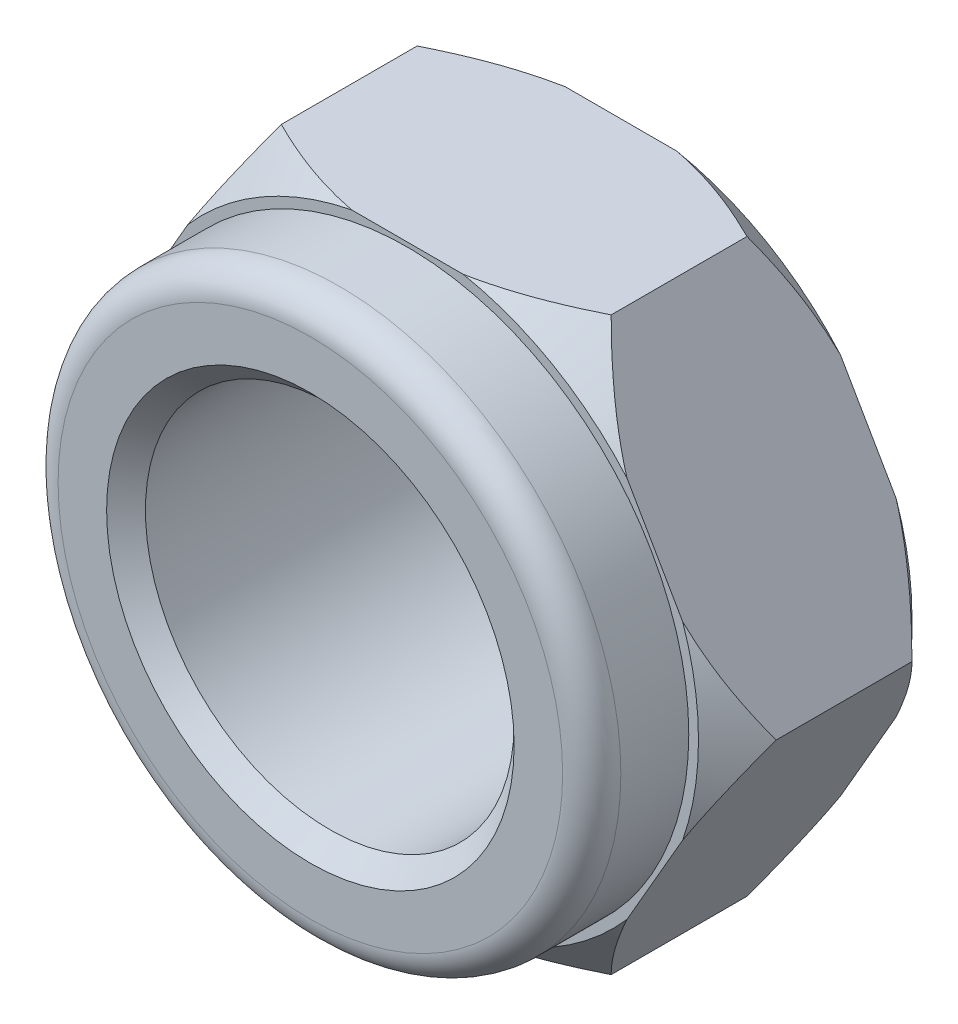
from build123d import *

# Parameters (mm, degrees)
ESQUISSE1_R                  = 17
CORPS_DE_MANOEUVRE_DEPTH     = 11
ESQUISSE2_R                  = 14.5
ORGANE_DE_FREIN_DEPTH        = 5
ESQUISSE3_R                  = 9.5
PER_AGE_DEPTH                = 29.879058156
CHANFREIN_DE_MANOEUVRE_SIZE  = 2
HEXAGON_INSCRIBED1_OUTSIDE_W = 46.136
HEXAGON_INSCRIBED1_OUTSIDE_H = 46.136
MANOEUVRE_DEPTH              = 39.920108467
CONG_1_R                     = 1.5
CHANFREIN2_SIZE              = 1


with BuildPart() as part:
    # Esquisse1 → corps de manoeuvre (new body)
    with BuildSketch(Plane.XY):
        Circle(ESQUISSE1_R)
    extrude(amount=CORPS_DE_MANOEUVRE_DEPTH)

    # Esquisse2 → organe de frein (add)
    with BuildSketch(Plane.XY.offset(11)):
        Circle(ESQUISSE2_R)
    extrude(amount=ORGANE_DE_FREIN_DEPTH)

    # Esquisse3 → perçage (cut, through all)
    with BuildSketch(Plane.XY.offset(16)):
        Circle(ESQUISSE3_R)
    extrude(amount=-PER_AGE_DEPTH, mode=Mode.SUBTRACT)

    # Chanfrein de manoeuvre
    chanfrein_de_manoeuvre_edges = [part.edges().sort_by_distance(p)[0] for p in [
        (-17, 0, 0),
        (-17, 0, 11),
    ]]
    chamfer(chanfrein_de_manoeuvre_edges, length=CHANFREIN_DE_MANOEUVRE_SIZE)

    # Hexagon - inscribed1 outside → manoeuvre (cut, through all)
    with BuildSketch(Plane(origin=(1.77823943, 13.102368129, 0), x_dir=(-1, 0, 0), z_dir=(0, 0, -1))):
        with Locations((1.778, -13.102)):
            Rectangle(HEXAGON_INSCRIBED1_OUTSIDE_W, HEXAGON_INSCRIBED1_OUTSIDE_H)
        Polygon((18.77823943, -13.102368129), (10.27823943, 1.620063735), (-6.72176057, 1.620063735), (-15.22176057, -13.102368129), (-6.72176057, -27.824799994), (10.27823943, -27.824799994), align=None, mode=Mode.SUBTRACT)
    extrude(amount=-MANOEUVRE_DEPTH, mode=Mode.SUBTRACT)

    # Congé1
    cong_1_edges = [part.edges().sort_by_distance(p)[0] for p in [
        (-14.5, 0, 16),
    ]]
    fillet(cong_1_edges, radius=CONG_1_R)

    # Chanfrein2
    chanfrein2_edges = [part.edges().sort_by_distance(p)[0] for p in [
        (-9.5, 0, 16),
        (-9.5, 0, 0),
    ]]
    chamfer(chanfrein2_edges, length=CHANFREIN2_SIZE)


solid = part.part
